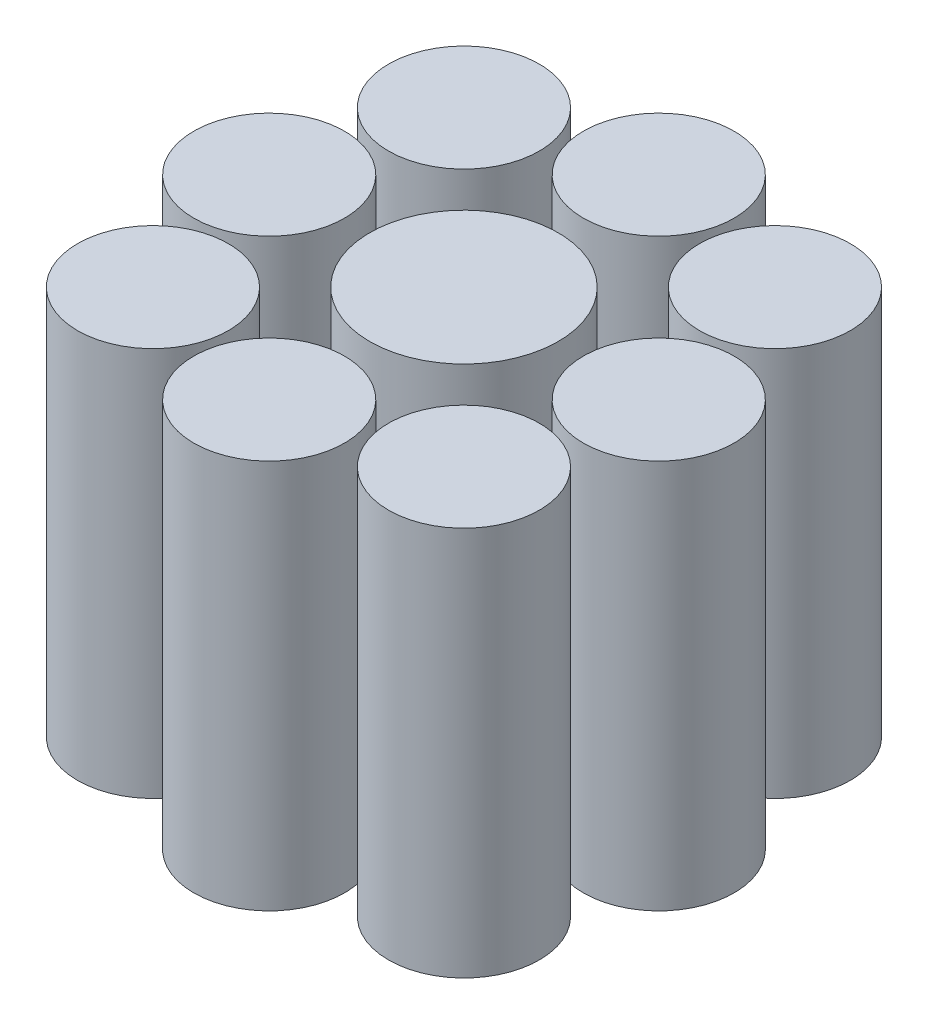
from build123d import *

# Parameters (mm, degrees)
SKETCH_2_R        = 15
EXTRUDE_2_DEPTH   = 62
SKETCH_2_R_2      = 12
EXTRUDE_2_2_DEPTH = 62
EXTRUDE_2_3_DEPTH = 62
EXTRUDE_2_4_DEPTH = 62
EXTRUDE_2_5_DEPTH = 62
EXTRUDE_2_6_DEPTH = 62
EXTRUDE_2_7_DEPTH = 62
EXTRUDE_2_8_DEPTH = 62
EXTRUDE_2_9_DEPTH = 62


with BuildPart() as part:
    # 草图2 → 凸台-拉伸2 (new body)
    with BuildSketch(Plane(origin=(0, 0, 0), x_dir=(1, 0, 0), z_dir=(0, 1, 0))):
        with Locations(Location((0, 0, 0), (0, 0, 270))):
            Circle(SKETCH_2_R)
    extrude(amount=EXTRUDE_2_DEPTH)


with BuildPart() as body_2:
    # 草图2 → Extrude 2 2 (new body)
    with BuildSketch(Plane(origin=(0, 0, 0), x_dir=(1, 0, 0), z_dir=(0, 1, 0))):
        with Locations(Location((31, 0, 0), (0, 0, 270))):
            Circle(SKETCH_2_R_2)
    extrude(amount=EXTRUDE_2_2_DEPTH)


with BuildPart() as body_3:
    # 草图2 → Extrude 2 3 (new body)
    with BuildSketch(Plane(origin=(0, 0, 0), x_dir=(1, 0, 0), z_dir=(0, 1, 0))):
        with Locations(Location((0, -31, 0), (0, 0, 270))):
            Circle(SKETCH_2_R_2)
    extrude(amount=EXTRUDE_2_3_DEPTH)


with BuildPart() as body_4:
    # 草图2 → Extrude 2 4 (new body)
    with BuildSketch(Plane(origin=(0, 0, 0), x_dir=(1, 0, 0), z_dir=(0, 1, 0))):
        with Locations(Location((-31, 0, 0), (0, 0, 270))):
            Circle(SKETCH_2_R_2)
    extrude(amount=EXTRUDE_2_4_DEPTH)


with BuildPart() as body_5:
    # 草图2 → Extrude 2 5 (new body)
    with BuildSketch(Plane(origin=(0, 0, 0), x_dir=(1, 0, 0), z_dir=(0, 1, 0))):
        with Locations(Location((0, 31, 0), (0, 0, 270))):
            Circle(SKETCH_2_R_2)
    extrude(amount=EXTRUDE_2_5_DEPTH)


with BuildPart() as body_6:
    # 草图2 → Extrude 2 6 (new body)
    with BuildSketch(Plane(origin=(0, 0, 0), x_dir=(1, 0, 0), z_dir=(0, 1, 0))):
        with Locations(Location((24.748737342, -24.748737342, 0), (0, 0, 270))):
            Circle(SKETCH_2_R_2)
    extrude(amount=EXTRUDE_2_6_DEPTH)


with BuildPart() as body_7:
    # 草图2 → Extrude 2 7 (new body)
    with BuildSketch(Plane(origin=(0, 0, 0), x_dir=(1, 0, 0), z_dir=(0, 1, 0))):
        with Locations(Location((-24.748737342, -24.748737342, 0), (0, 0, 270))):
            Circle(SKETCH_2_R_2)
    extrude(amount=EXTRUDE_2_7_DEPTH)


with BuildPart() as body_8:
    # 草图2 → Extrude 2 8 (new body)
    with BuildSketch(Plane(origin=(0, 0, 0), x_dir=(1, 0, 0), z_dir=(0, 1, 0))):
        with Locations(Location((-24.748737342, 24.748737342, 0), (0, 0, 270))):
            Circle(SKETCH_2_R_2)
    extrude(amount=EXTRUDE_2_8_DEPTH)


with BuildPart() as body_9:
    # 草图2 → Extrude 2 9 (new body)
    with BuildSketch(Plane(origin=(0, 0, 0), x_dir=(1, 0, 0), z_dir=(0, 1, 0))):
        with Locations(Location((24.748737342, 24.748737342, 0), (0, 0, 270))):
            Circle(SKETCH_2_R_2)
    extrude(amount=EXTRUDE_2_9_DEPTH)


solid = Compound([part.part, body_2.part, body_3.part, body_4.part, body_5.part, body_6.part, body_7.part, body_8.part, body_9.part])
